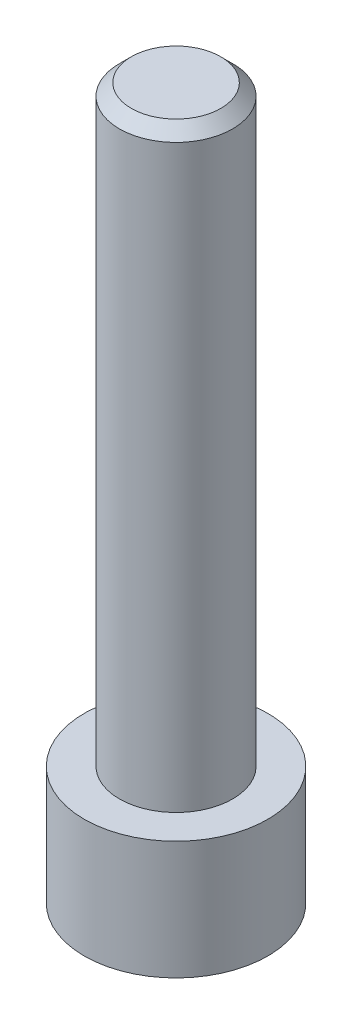
from build123d import *

# Parameters (mm, degrees)
SKETCH1_R           = 3.875
BOSS_EXTRUDE1_DEPTH = 30
SKETCH2_OUTSIDE_W   = 16.138
SKETCH2_OUTSIDE_H   = 16.138
SKETCH2_OUTSIDE_R   = 2.39
CUT_EXTRUDE1_DEPTH  = 25
CHAMFER1_SIZE       = 0.5
CUT_EXTRUDE2_DEPTH  = 3.36


with BuildPart() as part:
    # Sketch1 → Boss-Extrude1 (new body)
    with BuildSketch(Plane(origin=(0, 0, 0), x_dir=(1, 0, 0), z_dir=(0, 1, 0))):
        Circle(SKETCH1_R)
    extrude(amount=BOSS_EXTRUDE1_DEPTH)

    # Sketch2 outside → Cut-Extrude1 (cut)
    with BuildSketch(Plane(origin=(0, 30, 0), x_dir=(1, 0, 0), z_dir=(0, 1, 0))):
        Rectangle(SKETCH2_OUTSIDE_W, SKETCH2_OUTSIDE_H)
        Circle(SKETCH2_OUTSIDE_R, mode=Mode.SUBTRACT)
    extrude(amount=-CUT_EXTRUDE1_DEPTH, mode=Mode.SUBTRACT)

    # Chamfer1
    chamfer1_edges = [part.edges().sort_by_distance(p)[0] for p in [
        (-2.39, 30, 0),
    ]]
    chamfer(chamfer1_edges, length=CHAMFER1_SIZE)

    # Sketch8 → Cut-Extrude2 (cut)
    with BuildSketch(Plane.XZ):
        Polygon((2.644264233, 0), (1.322132116, 2.29), (-1.322132116, 2.29), (-2.644264233, 0), (-1.322132116, -2.29), (1.322132116, -2.29), align=None)
    extrude(amount=-CUT_EXTRUDE2_DEPTH, mode=Mode.SUBTRACT)


solid = part.part
